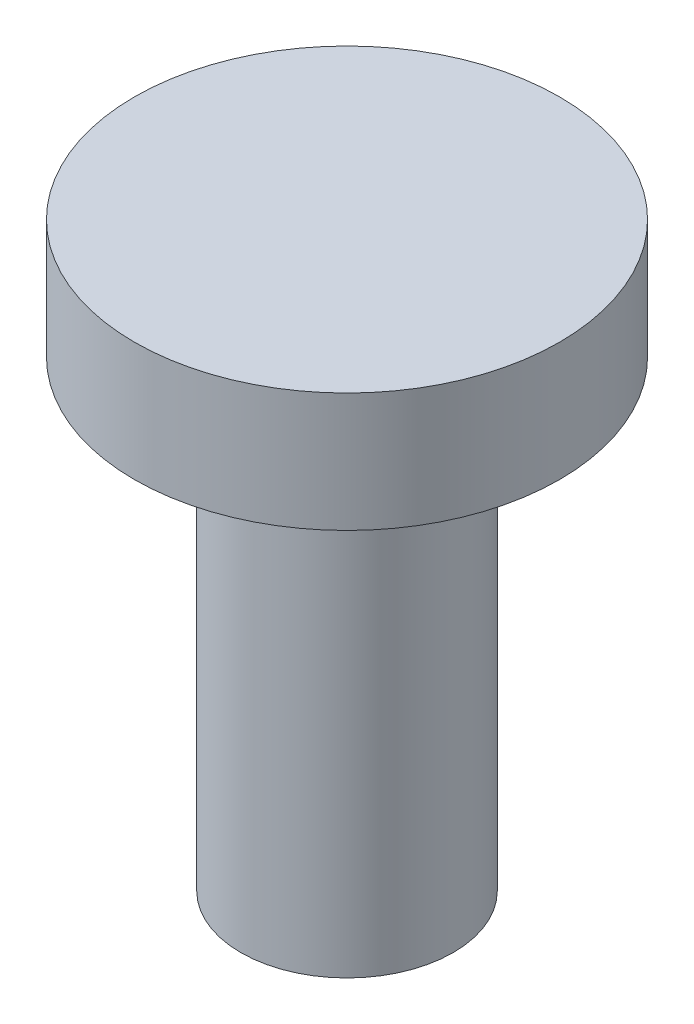
from build123d import *

# Parameters (mm, degrees)
SKETCH1_R                = 5
SKETCH1_R_2              = 2.5
BOSS_EXTRUDE2_DEPTH      = 3
BOSS_EXTRUDE3_DEPTH      = 10.885792211
BOSS_EXTRUDE3_DEPTH_BACK = 3
SKETCH5_R                = 2.5
CUT_EXTRUDE3_START       = -0.2
SKETCH6_R                = 5
CUT_EXTRUDE3_DEPTH       = 0.2


with BuildPart() as part:
    # Sketch1 → Boss-Extrude2 (new body)
    with BuildSketch(Plane(origin=(0, 0, 0), x_dir=(1, 0, 0), z_dir=(0, 1, 0))):
        with Locations(Location((0, 0, 0), (0, 0, 270))):
            Circle(SKETCH1_R)
        with Locations(Location((0, 0, 0), (0, 0, 270))):
            Circle(SKETCH1_R_2, mode=Mode.SUBTRACT)
    extrude(amount=BOSS_EXTRUDE2_DEPTH)

    # Sketch5 → Boss-Extrude3 (add, two sides: drawn at the far end of the back side and taken through both)
    with BuildSketch(Plane.XZ.offset(-BOSS_EXTRUDE3_DEPTH_BACK)):
        with Locations(Location((0, 0, 0), (0, 0, 270))):
            Circle(SKETCH5_R)
    extrude(amount=BOSS_EXTRUDE3_DEPTH + BOSS_EXTRUDE3_DEPTH_BACK)

    # Sketch6 → Cut-Extrude3 (cut)
    with BuildSketch(Plane(origin=(0, 3, 0), x_dir=(1, 0, 0), z_dir=(0, 1, 0)).offset(CUT_EXTRUDE3_START)):
        with Locations(Location((0, 0, 0), (0, 0, 270))):
            Circle(SKETCH6_R)
    extrude(amount=CUT_EXTRUDE3_DEPTH, mode=Mode.SUBTRACT)


solid = part.part
